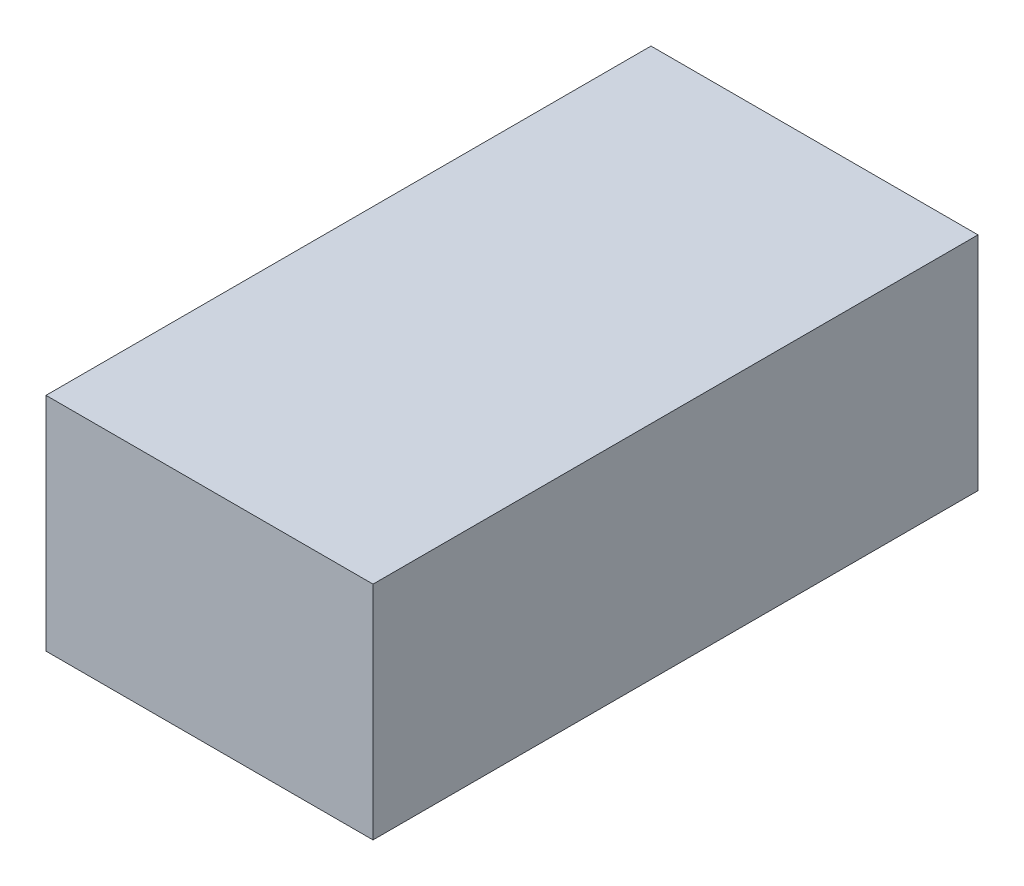
from build123d import *

# Parameters (mm, degrees)
AIR_BOX_START      = -800
SKETCH1_W          = 3700
SKETCH1_H          = 1355
AIR_BOX_DEPTH      = 2000
WHEEL_START        = -190
SKETCH2_R          = 360
SKETCH2_R_2        = 200
WHEEL_DEPTH        = 285
COVER_START        = -200
SKETCH3_R          = 360
COVER_DEPTH        = 10
SKETCH4_R          = 164
ROTOR_DEPTH        = 16
THROAT_OUTER_START = 18
SKETCH5_W          = 64
SKETCH5_H          = 104
THROAT_OUTER_DEPTH = 82
SCOOP_OUTER_START  = 98
SKETCH6_W          = 332
SKETCH6_H          = 104
SCOOP_OUTER_DEPTH  = 64
THROAT_INNER_START = 10
SKETCH7_W          = 60
SKETCH7_H          = 100
THROAT_INNER_DEPTH = 91
SCOOP_INNER_START  = 100
SKETCH8_W          = 340
SKETCH8_H          = 100
SCOOP_INNER_DEPTH  = 60
LOUVER1_START      = 49
SKETCH9_W          = 56
SKETCH9_H          = 2
LOUVER1_DEPTH      = 18
LOUVER2_START      = 49
SKETCH10_W         = 56
SKETCH10_H         = 2
LOUVER2_DEPTH      = 18
LOUVER3_START      = 49
SKETCH11_W         = 56
SKETCH11_H         = 2
LOUVER3_DEPTH      = 18
LOUVER4_START      = 49
SKETCH12_W         = 56
SKETCH12_H         = 2
LOUVER4_DEPTH      = 18


with BuildPart() as part:
    # Sketch1 → air_box (new body)
    with BuildSketch(Plane(origin=(0, 0, 0), x_dir=(0, 0, -1), z_dir=(1, 0, 0)).offset(AIR_BOX_START)):
        with Locations((650, 322.5)):
            Rectangle(SKETCH1_W, SKETCH1_H)
    extrude(amount=AIR_BOX_DEPTH)


with BuildPart() as body_2:
    # Sketch2 → wheel (new body)
    with BuildSketch(Plane(origin=(0, 0, 0), x_dir=(0, 0, -1), z_dir=(1, 0, 0)).offset(WHEEL_START)):
        Circle(SKETCH2_R)
        Circle(SKETCH2_R_2, mode=Mode.SUBTRACT)
    extrude(amount=WHEEL_DEPTH)


with BuildPart() as body_3:
    # Sketch3 → cover (new body)
    with BuildSketch(Plane(origin=(0, 0, 0), x_dir=(0, 0, -1), z_dir=(1, 0, 0)).offset(COVER_START)):
        Circle(SKETCH3_R)
    extrude(amount=COVER_DEPTH)


with BuildPart() as body_4:
    # Sketch4 → rotor (new, symmetric)
    with BuildSketch(Plane(origin=(0, 0, 0), x_dir=(0, 0, -1), z_dir=(1, 0, 0))):
        Circle(SKETCH4_R)
    extrude(amount=ROTOR_DEPTH, both=True)


with BuildPart() as body_5:
    # Sketch5 → throat_outer (new body)
    with BuildSketch(Plane(origin=(0, 0, 0), x_dir=(0, 0, -1), z_dir=(1, 0, 0)).offset(THROAT_OUTER_START)):
        with Locations((0, 140)):
            Rectangle(SKETCH5_W, SKETCH5_H)
    extrude(amount=THROAT_OUTER_DEPTH)


with BuildPart() as body_6:
    # Sketch6 → scoop_outer (new body)
    with BuildSketch(Plane(origin=(0, 0, 0), x_dir=(0, 0, -1), z_dir=(1, 0, 0)).offset(SCOOP_OUTER_START)):
        with Locations((-134, 140)):
            Rectangle(SKETCH6_W, SKETCH6_H)
    extrude(amount=SCOOP_OUTER_DEPTH)

    # Combine1: union body 5
    add(body_5.part)


with BuildPart() as body_6_2:
    # Sketch7 → throat_inner (new body)
    with BuildSketch(Plane(origin=(0, 0, 0), x_dir=(0, 0, -1), z_dir=(1, 0, 0)).offset(THROAT_INNER_START)):
        with Locations((0, 140)):
            Rectangle(SKETCH7_W, SKETCH7_H)
    extrude(amount=THROAT_INNER_DEPTH)


with BuildPart() as body_7:
    # Sketch8 → scoop_inner (new body)
    with BuildSketch(Plane(origin=(0, 0, 0), x_dir=(0, 0, -1), z_dir=(1, 0, 0)).offset(SCOOP_INNER_START)):
        with Locations((-140, 140)):
            Rectangle(SKETCH8_W, SKETCH8_H)
    extrude(amount=SCOOP_INNER_DEPTH)


with BuildPart() as body_6_1:
    add(body_6.part)

    # Combine2: cut body 6 2, body 7
    add(body_6_2.part, mode=Mode.SUBTRACT)
    add(body_7.part, mode=Mode.SUBTRACT)


with BuildPart() as body_6_3:
    # Sketch9 → louver1 (new body)
    with BuildSketch(Plane(origin=(0, 0, 0), x_dir=(0, 0, -1), z_dir=(1, 0, 0)).offset(LOUVER1_START)):
        with Locations((0, 110)):
            Rectangle(SKETCH9_W, SKETCH9_H)
    extrude(amount=LOUVER1_DEPTH)


with BuildPart() as body_7_2:
    # Sketch10 → louver2 (new body)
    with BuildSketch(Plane(origin=(0, 0, 0), x_dir=(0, 0, -1), z_dir=(1, 0, 0)).offset(LOUVER2_START)):
        with Locations((0, 130)):
            Rectangle(SKETCH10_W, SKETCH10_H)
    extrude(amount=LOUVER2_DEPTH)


with BuildPart() as body_8:
    # Sketch11 → louver3 (new body)
    with BuildSketch(Plane(origin=(0, 0, 0), x_dir=(0, 0, -1), z_dir=(1, 0, 0)).offset(LOUVER3_START)):
        with Locations((0, 150)):
            Rectangle(SKETCH11_W, SKETCH11_H)
    extrude(amount=LOUVER3_DEPTH)


with BuildPart() as body_9:
    # Sketch12 → louver4 (new body)
    with BuildSketch(Plane(origin=(0, 0, 0), x_dir=(0, 0, -1), z_dir=(1, 0, 0)).offset(LOUVER4_START)):
        with Locations((0, 170)):
            Rectangle(SKETCH12_W, SKETCH12_H)
    extrude(amount=LOUVER4_DEPTH)


with BuildPart() as part_1:
    add(part.part)

    # Combine3: cut body 2
    add(body_2.part, mode=Mode.SUBTRACT)

    # Combine4: cut body 3
    add(body_3.part, mode=Mode.SUBTRACT)

    # Combine5: cut body 4
    add(body_4.part, mode=Mode.SUBTRACT)

    # Combine6: cut body 6
    add(body_6_1.part, mode=Mode.SUBTRACT)

    # Combine7: cut body 6 3
    add(body_6_3.part, mode=Mode.SUBTRACT)

    # Combine8: cut body 7 2
    add(body_7_2.part, mode=Mode.SUBTRACT)

    # Combine9: cut body 8
    add(body_8.part, mode=Mode.SUBTRACT)

    # Combine10: cut body 9
    add(body_9.part, mode=Mode.SUBTRACT)


solid = part_1.part
